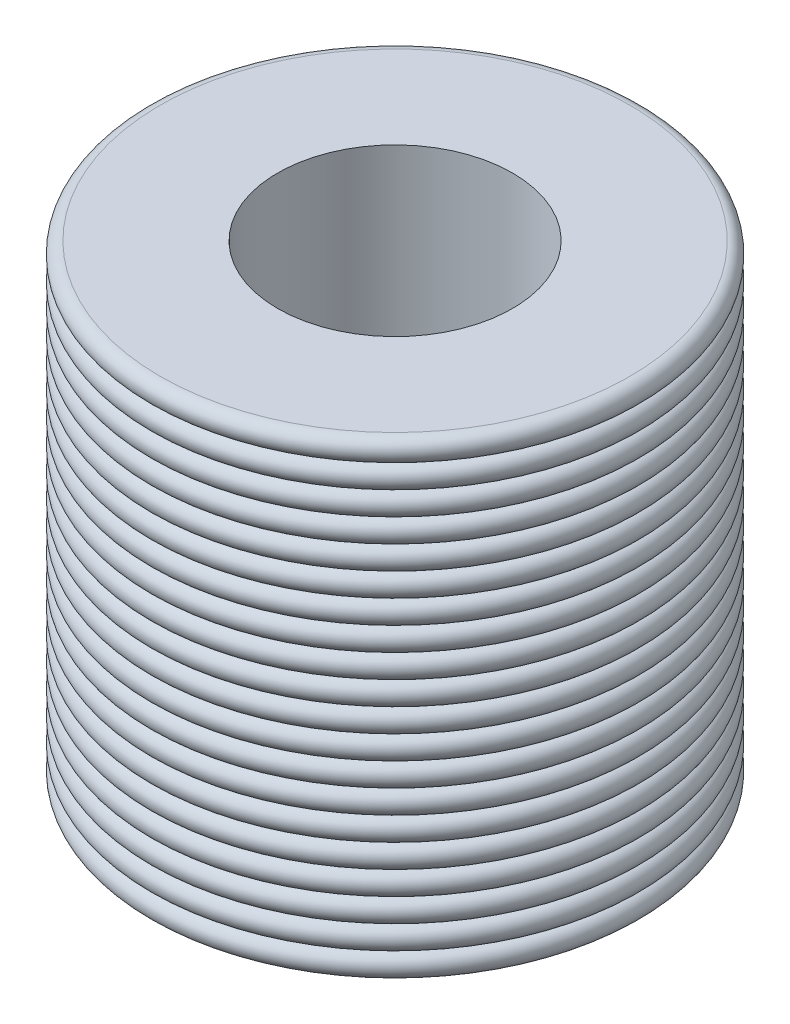
from build123d import *


with BuildPart() as part:
    # Sketch1 → Revolve1 (revolve)
    with BuildSketch(Plane(origin=(0, 0, 0), x_dir=(0, 0, -1), z_dir=(1, 0, 0))):
        with BuildLine():
            ThreePointArc((-20, -12.348314607), (-21, -13.348314607), (-20, -14.348314607))
            ThreePointArc((-20, -14.348314607), (-21, -15.348314607), (-20, -16.348314607))
            Line((-20, -16.348314607), (-10, -16.348314607))
            Line((-10, -16.348314607), (-10, 23.651685393))
            Line((-10, 23.651685393), (-20, 23.651685393))
            ThreePointArc((-20, 23.651685393), (-21, 22.651685393), (-20, 21.651685393))
            ThreePointArc((-20, 21.651685393), (-21, 20.651685393), (-20, 19.651685393))
            ThreePointArc((-20, 19.651685393), (-21, 18.651685393), (-20, 17.651685393))
            ThreePointArc((-20, 17.651685393), (-21, 16.651685393), (-20, 15.651685393))
            ThreePointArc((-20, 15.651685393), (-21, 14.651685393), (-20, 13.651685393))
            ThreePointArc((-20, 13.651685393), (-21, 12.651685393), (-20, 11.651685393))
            ThreePointArc((-20, 11.651685393), (-21, 10.651685393), (-20, 9.651685393))
            ThreePointArc((-20, 9.651685393), (-21, 8.651685393), (-20, 7.651685393))
            ThreePointArc((-20, 7.651685393), (-21, 6.651685393), (-20, 5.651685393))
            ThreePointArc((-20, 5.651685393), (-21, 4.651685393), (-20, 3.651685393))
            ThreePointArc((-20, 3.651685393), (-21, 2.651685393), (-20, 1.651685393))
            ThreePointArc((-20, 1.651685393), (-21, 0.651685393), (-20, -0.348314607))
            ThreePointArc((-20, -0.348314607), (-21, -1.348314607), (-20, -2.348314607))
            ThreePointArc((-20, -2.348314607), (-21, -3.348314607), (-20, -4.348314607))
            ThreePointArc((-20, -4.348314607), (-21, -5.348314607), (-20, -6.348314607))
            ThreePointArc((-20, -6.348314607), (-21, -7.348314607), (-20, -8.348314607))
            ThreePointArc((-20, -8.348314607), (-21, -9.348314607), (-20, -10.348314607))
            ThreePointArc((-20, -10.348314607), (-21, -11.348314607), (-20, -12.348314607))
        make_face()
    revolve(axis=Axis((0, 24.662921348, 0), (0, -1, 0)))


solid = part.part
